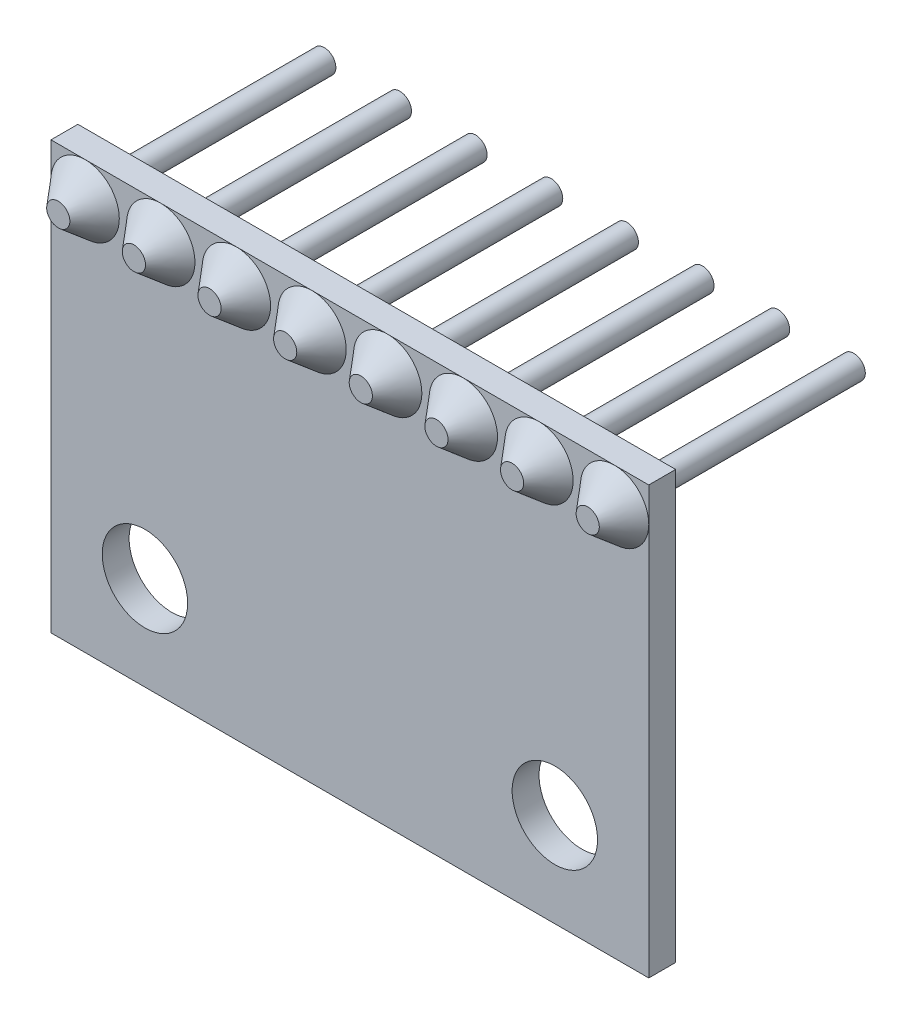
from build123d import *

# Parameters (mm, degrees)
SKETCH1_W                     = 22.225
SKETCH1_H                     = 15.875
SKETCH1_R                     = 1.5875
BOSS_EXTRUDE1_DEPTH           = 1
SKETCH2_W                     = 3
SKETCH2_H                     = 4
BOSS_EXTRUDE2_DEPTH           = 1
SKETCH3_R                     = 1.27
BOSS_EXTRUDE3_DEPTH           = 1
BOSS_EXTRUDE3_DRAFT           = 40
BOSS_EXTRUDE3_PROFILE_2_DEPTH = 1
BOSS_EXTRUDE3_PROFILE_2_DRAFT = 40
BOSS_EXTRUDE3_PROFILE_3_DEPTH = 1
BOSS_EXTRUDE3_PROFILE_3_DRAFT = 40
BOSS_EXTRUDE3_PROFILE_4_DEPTH = 1
BOSS_EXTRUDE3_PROFILE_4_DRAFT = 40
BOSS_EXTRUDE3_PROFILE_5_DEPTH = 1
BOSS_EXTRUDE3_PROFILE_5_DRAFT = 40
BOSS_EXTRUDE3_PROFILE_6_DEPTH = 1
BOSS_EXTRUDE3_PROFILE_6_DRAFT = 40
BOSS_EXTRUDE3_PROFILE_7_DEPTH = 1
BOSS_EXTRUDE3_PROFILE_7_DRAFT = 40
BOSS_EXTRUDE3_PROFILE_8_DEPTH = 1
BOSS_EXTRUDE3_PROFILE_8_DRAFT = 40
SKETCH4_R                     = 0.430900369
BOSS_EXTRUDE4_DEPTH           = 9.89


with BuildPart() as part:
    # Sketch1 → Boss-Extrude1 (new body)
    with BuildSketch(Plane.XY):
        with Locations((-11.1125, 7.9375)):
            Rectangle(SKETCH1_W, SKETCH1_H)
        with Locations((-18.7325, 3.4925)):
            Circle(SKETCH1_R, mode=Mode.SUBTRACT)
        with Locations((-3.4925, 3.4925)):
            Circle(SKETCH1_R, mode=Mode.SUBTRACT)
    extrude(amount=BOSS_EXTRUDE1_DEPTH)

    # Sketch2 → Boss-Extrude2 (add)
    with BuildSketch(Plane.XY):
        with Locations((-11.1125, 9.812715541)):
            Rectangle(SKETCH2_W, SKETCH2_H)
    extrude(amount=-BOSS_EXTRUDE2_DEPTH)


with BuildPart() as boss_extrude3_tool:
    # Sketch3 → Boss-Extrude3 (with draft: the straight prism first)
    with BuildSketch(Plane.XY.offset(1)):
        with Locations((-20.955, 14.605)):
            Circle(SKETCH3_R)
    extrude(amount=BOSS_EXTRUDE3_DEPTH)
    # Boss-Extrude3: the draft: its side faces are tilted about the plane it starts from
    boss_extrude3_sides = [boss_extrude3_tool.faces().sort_by_distance(p)[0] for p in [
        (-22.225, 14.605, 1.5),
    ]]
    draft(boss_extrude3_sides, Plane.XY.offset(1), BOSS_EXTRUDE3_DRAFT)


with BuildPart() as part_1:
    add(part.part)

    # Boss-Extrude3: add boss_extrude3_tool
    add(boss_extrude3_tool.part)


with BuildPart() as boss_extrude3_profile_2_tool:
    # Sketch3 → Boss-Extrude3 profile 2 (with draft: the straight prism first)
    with BuildSketch(Plane.XY.offset(1)):
        with Locations((-18.142857143, 14.605)):
            Circle(SKETCH3_R)
    extrude(amount=BOSS_EXTRUDE3_PROFILE_2_DEPTH)
    # Boss-Extrude3 profile 2: the draft: its side faces are tilted about the plane it starts from
    boss_extrude3_profile_2_sides = [boss_extrude3_profile_2_tool.faces().sort_by_distance(p)[0] for p in [
        (-19.412857143, 14.605, 1.5),
    ]]
    draft(boss_extrude3_profile_2_sides, Plane.XY.offset(1), BOSS_EXTRUDE3_PROFILE_2_DRAFT)


with BuildPart() as part_2:
    add(part_1.part)

    # Boss-Extrude3 profile 2: add boss_extrude3_profile_2_tool
    add(boss_extrude3_profile_2_tool.part)


with BuildPart() as boss_extrude3_profile_3_tool:
    # Sketch3 → Boss-Extrude3 profile 3 (with draft: the straight prism first)
    with BuildSketch(Plane.XY.offset(1)):
        with Locations((-15.330714286, 14.605)):
            Circle(SKETCH3_R)
    extrude(amount=BOSS_EXTRUDE3_PROFILE_3_DEPTH)
    # Boss-Extrude3 profile 3: the draft: its side faces are tilted about the plane it starts from
    boss_extrude3_profile_3_sides = [boss_extrude3_profile_3_tool.faces().sort_by_distance(p)[0] for p in [
        (-16.600714286, 14.605, 1.5),
    ]]
    draft(boss_extrude3_profile_3_sides, Plane.XY.offset(1), BOSS_EXTRUDE3_PROFILE_3_DRAFT)


with BuildPart() as part_3:
    add(part_2.part)

    # Boss-Extrude3 profile 3: add boss_extrude3_profile_3_tool
    add(boss_extrude3_profile_3_tool.part)


with BuildPart() as boss_extrude3_profile_4_tool:
    # Sketch3 → Boss-Extrude3 profile 4 (with draft: the straight prism first)
    with BuildSketch(Plane.XY.offset(1)):
        with Locations((-12.518571429, 14.605)):
            Circle(SKETCH3_R)
    extrude(amount=BOSS_EXTRUDE3_PROFILE_4_DEPTH)
    # Boss-Extrude3 profile 4: the draft: its side faces are tilted about the plane it starts from
    boss_extrude3_profile_4_sides = [boss_extrude3_profile_4_tool.faces().sort_by_distance(p)[0] for p in [
        (-13.788571429, 14.605, 1.5),
    ]]
    draft(boss_extrude3_profile_4_sides, Plane.XY.offset(1), BOSS_EXTRUDE3_PROFILE_4_DRAFT)


with BuildPart() as part_4:
    add(part_3.part)

    # Boss-Extrude3 profile 4: add boss_extrude3_profile_4_tool
    add(boss_extrude3_profile_4_tool.part)


with BuildPart() as boss_extrude3_profile_5_tool:
    # Sketch3 → Boss-Extrude3 profile 5 (with draft: the straight prism first)
    with BuildSketch(Plane.XY.offset(1)):
        with Locations((-9.706428571, 14.605)):
            Circle(SKETCH3_R)
    extrude(amount=BOSS_EXTRUDE3_PROFILE_5_DEPTH)
    # Boss-Extrude3 profile 5: the draft: its side faces are tilted about the plane it starts from
    boss_extrude3_profile_5_sides = [boss_extrude3_profile_5_tool.faces().sort_by_distance(p)[0] for p in [
        (-10.976428571, 14.605, 1.5),
    ]]
    draft(boss_extrude3_profile_5_sides, Plane.XY.offset(1), BOSS_EXTRUDE3_PROFILE_5_DRAFT)


with BuildPart() as part_5:
    add(part_4.part)

    # Boss-Extrude3 profile 5: add boss_extrude3_profile_5_tool
    add(boss_extrude3_profile_5_tool.part)


with BuildPart() as boss_extrude3_profile_6_tool:
    # Sketch3 → Boss-Extrude3 profile 6 (with draft: the straight prism first)
    with BuildSketch(Plane.XY.offset(1)):
        with Locations((-6.894285714, 14.605)):
            Circle(SKETCH3_R)
    extrude(amount=BOSS_EXTRUDE3_PROFILE_6_DEPTH)
    # Boss-Extrude3 profile 6: the draft: its side faces are tilted about the plane it starts from
    boss_extrude3_profile_6_sides = [boss_extrude3_profile_6_tool.faces().sort_by_distance(p)[0] for p in [
        (-8.164285714, 14.605, 1.5),
    ]]
    draft(boss_extrude3_profile_6_sides, Plane.XY.offset(1), BOSS_EXTRUDE3_PROFILE_6_DRAFT)


with BuildPart() as part_6:
    add(part_5.part)

    # Boss-Extrude3 profile 6: add boss_extrude3_profile_6_tool
    add(boss_extrude3_profile_6_tool.part)


with BuildPart() as boss_extrude3_profile_7_tool:
    # Sketch3 → Boss-Extrude3 profile 7 (with draft: the straight prism first)
    with BuildSketch(Plane.XY.offset(1)):
        with Locations((-4.082142857, 14.605)):
            Circle(SKETCH3_R)
    extrude(amount=BOSS_EXTRUDE3_PROFILE_7_DEPTH)
    # Boss-Extrude3 profile 7: the draft: its side faces are tilted about the plane it starts from
    boss_extrude3_profile_7_sides = [boss_extrude3_profile_7_tool.faces().sort_by_distance(p)[0] for p in [
        (-5.352142857, 14.605, 1.5),
    ]]
    draft(boss_extrude3_profile_7_sides, Plane.XY.offset(1), BOSS_EXTRUDE3_PROFILE_7_DRAFT)


with BuildPart() as part_7:
    add(part_6.part)

    # Boss-Extrude3 profile 7: add boss_extrude3_profile_7_tool
    add(boss_extrude3_profile_7_tool.part)


with BuildPart() as boss_extrude3_profile_8_tool:
    # Sketch3 → Boss-Extrude3 profile 8 (with draft: the straight prism first)
    with BuildSketch(Plane.XY.offset(1)):
        with Locations((-1.27, 14.605)):
            Circle(SKETCH3_R)
    extrude(amount=BOSS_EXTRUDE3_PROFILE_8_DEPTH)
    # Boss-Extrude3 profile 8: the draft: its side faces are tilted about the plane it starts from
    boss_extrude3_profile_8_sides = [boss_extrude3_profile_8_tool.faces().sort_by_distance(p)[0] for p in [
        (-2.54, 14.605, 1.5),
    ]]
    draft(boss_extrude3_profile_8_sides, Plane.XY.offset(1), BOSS_EXTRUDE3_PROFILE_8_DRAFT)


with BuildPart() as part_8:
    add(part_7.part)

    # Boss-Extrude3 profile 8: add boss_extrude3_profile_8_tool
    add(boss_extrude3_profile_8_tool.part)

    # Sketch4 → Boss-Extrude4 (add)
    with BuildSketch(Plane.XY.offset(2)):
        with Locations((-20.955, 14.605)):
            Circle(SKETCH4_R)
        with Locations((-18.142857143, 14.605)):
            Circle(SKETCH4_R)
        with Locations((-15.330714286, 14.605)):
            Circle(SKETCH4_R)
        with Locations((-12.518571429, 14.605)):
            Circle(SKETCH4_R)
        with Locations((-9.706428571, 14.605)):
            Circle(SKETCH4_R)
        with Locations((-6.894285714, 14.605)):
            Circle(SKETCH4_R)
        with Locations((-4.082142857, 14.605)):
            Circle(SKETCH4_R)
        with Locations((-1.27, 14.605)):
            Circle(SKETCH4_R)
    extrude(amount=-BOSS_EXTRUDE4_DEPTH)


solid = part_8.part
